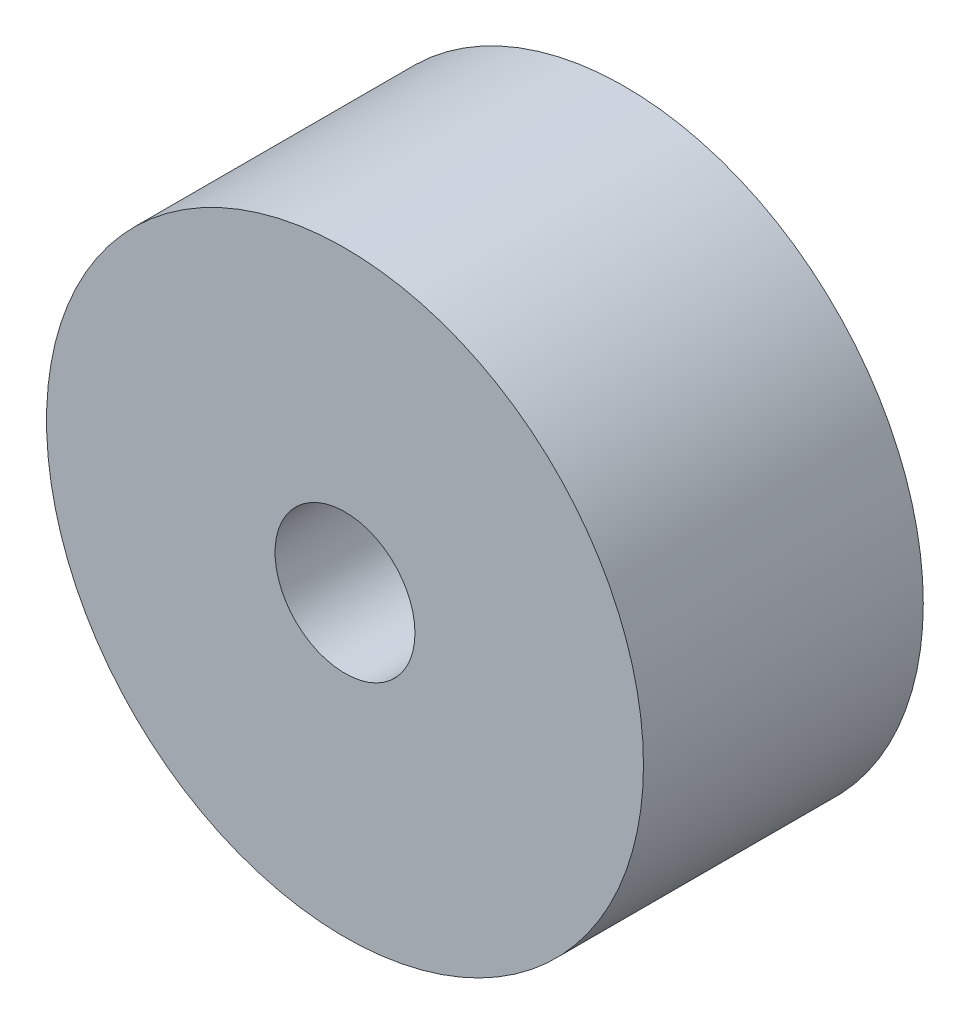
from build123d import *

# Parameters (mm, degrees)
SKETCH1_R           = 320
SKETCH1_R_2         = 75
BOSS_EXTRUDE1_DEPTH = 300


with BuildPart() as part:
    # Sketch1 → Boss-Extrude1 (new body)
    with BuildSketch(Plane.XY):
        Circle(SKETCH1_R)
        Circle(SKETCH1_R_2, mode=Mode.SUBTRACT)
    extrude(amount=BOSS_EXTRUDE1_DEPTH)


solid = part.part
